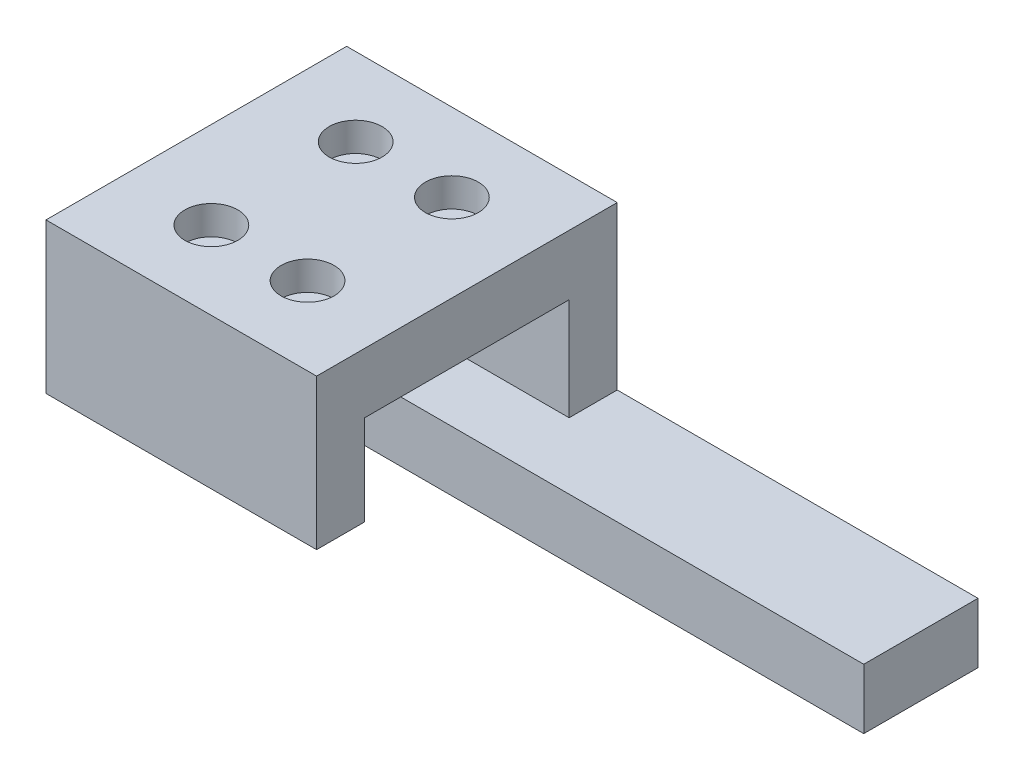
from build123d import *

# Parameters (mm, degrees)
SKETCH1_W                                           = 22.5
SKETCH1_H                                           = 17
SKETCH1_H_2                                         = 25
BOSS_EXTRUDE1_DEPTH                                 = 5
SKETCH1_3_W                                         = 22.5
SKETCH1_3_H                                         = 4
BOSS_EXTRUDE2_DEPTH                                 = 13.5
CBORE_FOR_M2_HEX_SOCKET_HEAD_CAP_SCREW1_D           = 2.4
CBORE_FOR_M2_HEX_SOCKET_HEAD_CAP_SCREW1_CBORE_D     = 4.4
CBORE_FOR_M2_HEX_SOCKET_HEAD_CAP_SCREW1_CBORE_DEPTH = 2.4
BOSS_EXTRUDE3_DEPTH                                 = 5
SKETCH1_4_W                                         = 22.5
SKETCH1_4_H                                         = 4
BOSS_EXTRUDE4_DEPTH                                 = 7.5


with BuildPart() as part:
    # Sketch1 → Boss-Extrude1 (new body)
    with BuildSketch(Plane(origin=(0, 0, 0), x_dir=(1, 0, 0), z_dir=(0, 1, 0))):
        Rectangle(SKETCH1_W, SKETCH1_H)
        Rectangle(SKETCH1_W, SKETCH1_H_2)
    extrude(amount=BOSS_EXTRUDE1_DEPTH)

    # Sketch1<3> → Boss-Extrude2 (add)
    with BuildSketch(Plane(origin=(0, 0, 0), x_dir=(1, 0, 0), z_dir=(0, 1, 0))):
        with Locations((0, 10.5)):
            Rectangle(SKETCH1_3_W, SKETCH1_3_H)
    extrude(amount=-BOSS_EXTRUDE2_DEPTH)

    # CBORE for M2 Hex Socket Head Cap Screw1 (through all)
    with Locations(Plane(origin=(0, 5, 0), x_dir=(1, 0, 0), z_dir=(0, 1, 0))):
        with Locations((-4, -6), (4, 6), (-4, 6), (4, -6)):
            CounterBoreHole(CBORE_FOR_M2_HEX_SOCKET_HEAD_CAP_SCREW1_D / 2, CBORE_FOR_M2_HEX_SOCKET_HEAD_CAP_SCREW1_CBORE_D / 2, CBORE_FOR_M2_HEX_SOCKET_HEAD_CAP_SCREW1_CBORE_DEPTH)

    # Sketch5 → Boss-Extrude3 (add)
    with BuildSketch(Plane.XZ.offset(13.5)):
        Polygon((-11.25, -3), (-11.25, -8.5), (11.25, -8.5), (11.25, -12.5), (41.25, -12.5), (41.25, -3), align=None)
    extrude(amount=-BOSS_EXTRUDE3_DEPTH)

    # Sketch1<4> → Boss-Extrude4 (add)
    with BuildSketch(Plane(origin=(0, 0, 0), x_dir=(1, 0, 0), z_dir=(0, 1, 0))):
        with Locations((0, -10.5)):
            Rectangle(SKETCH1_4_W, SKETCH1_4_H)
    extrude(amount=-BOSS_EXTRUDE4_DEPTH)


solid = part.part
